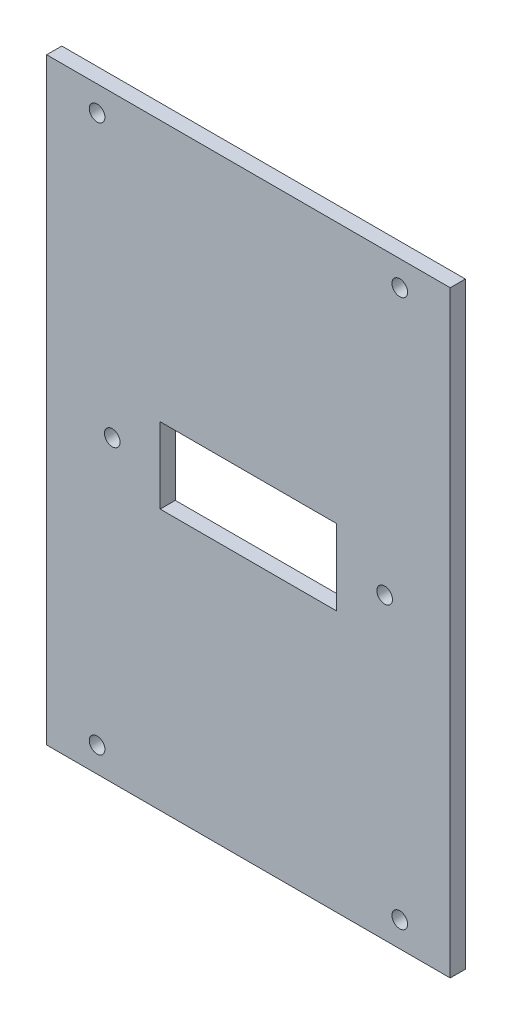
from build123d import *

# Parameters (mm, degrees)
SKETCH_1_W          = 80
SKETCH_1_H          = 118.5
SKETCH_1_W_2        = 35
SKETCH_1_H_2        = 15
EXTRUDE_1_DEPTH     = 3
CUT_EXTRUDE_2_REACH = 145.008
SKETCH_3_R          = 1.55
CUT_EXTRUDE_3_REACH = 145.008
SKETCH_4_R          = 1.55


with BuildPart() as part:
    # 草图1 → 凸台-拉伸1 (new body)
    with BuildSketch(Plane.XY):
        with Locations((40, 59.25)):
            Rectangle(SKETCH_1_W, SKETCH_1_H)
        with Locations((40, 59.25)):
            Rectangle(SKETCH_1_W_2, SKETCH_1_H_2, mode=Mode.SUBTRACT)
    extrude(amount=EXTRUDE_1_DEPTH)

    # 草图3 → 切除-拉伸2 (cut, up to next)
    with BuildSketch(Plane.XY.offset(3), mode=Mode.PRIVATE) as cut_extrude_2_sk1:
        with Locations((10, 113.5)):
            Circle(SKETCH_3_R)
    cut_extrude_2_tool1 = extrude(cut_extrude_2_sk1.sketch, amount=-CUT_EXTRUDE_2_REACH, mode=Mode.PRIVATE) & part.part
    # 草图3 → 切除-拉伸2 (cut, up to next)
    with BuildSketch(Plane.XY.offset(3), mode=Mode.PRIVATE) as cut_extrude_2_sk2:
        with Locations((70, 113.5)):
            Circle(SKETCH_3_R)
    cut_extrude_2_tool2 = extrude(cut_extrude_2_sk2.sketch, amount=-CUT_EXTRUDE_2_REACH, mode=Mode.PRIVATE) & part.part
    # 草图3 → 切除-拉伸2 (cut, up to next)
    with BuildSketch(Plane.XY.offset(3), mode=Mode.PRIVATE) as cut_extrude_2_sk3:
        with Locations((70, 5)):
            Circle(SKETCH_3_R)
    cut_extrude_2_tool3 = extrude(cut_extrude_2_sk3.sketch, amount=-CUT_EXTRUDE_2_REACH, mode=Mode.PRIVATE) & part.part
    # 草图3 → 切除-拉伸2 (cut, up to next)
    with BuildSketch(Plane.XY.offset(3), mode=Mode.PRIVATE) as cut_extrude_2_sk4:
        with Locations((10, 5)):
            Circle(SKETCH_3_R)
    cut_extrude_2_tool4 = extrude(cut_extrude_2_sk4.sketch, amount=-CUT_EXTRUDE_2_REACH, mode=Mode.PRIVATE) & part.part
    add(cut_extrude_2_tool1.solids().sort_by_distance((10, 113.5, 3))[0], mode=Mode.SUBTRACT)
    add(cut_extrude_2_tool2.solids().sort_by_distance((70, 113.5, 3))[0], mode=Mode.SUBTRACT)
    add(cut_extrude_2_tool3.solids().sort_by_distance((70, 5, 3))[0], mode=Mode.SUBTRACT)
    add(cut_extrude_2_tool4.solids().sort_by_distance((10, 5, 3))[0], mode=Mode.SUBTRACT)

    # 草图4 → 切除-拉伸3 (cut, up to next)
    with BuildSketch(Plane(origin=(0, 0, 0), x_dir=(-1, 0, 0), z_dir=(0, 0, -1)), mode=Mode.PRIVATE) as cut_extrude_3_sk1:
        with Locations((-67, 59.25)):
            Circle(SKETCH_4_R)
    cut_extrude_3_tool1 = extrude(cut_extrude_3_sk1.sketch, amount=-CUT_EXTRUDE_3_REACH, mode=Mode.PRIVATE) & part.part
    # 草图4 → 切除-拉伸3 (cut, up to next)
    with BuildSketch(Plane(origin=(0, 0, 0), x_dir=(-1, 0, 0), z_dir=(0, 0, -1)), mode=Mode.PRIVATE) as cut_extrude_3_sk2:
        with Locations((-13, 59.25)):
            Circle(SKETCH_4_R)
    cut_extrude_3_tool2 = extrude(cut_extrude_3_sk2.sketch, amount=-CUT_EXTRUDE_3_REACH, mode=Mode.PRIVATE) & part.part
    add(cut_extrude_3_tool1.solids().sort_by_distance((67, 59.25, 0))[0], mode=Mode.SUBTRACT)
    add(cut_extrude_3_tool2.solids().sort_by_distance((13, 59.25, 0))[0], mode=Mode.SUBTRACT)


solid = part.part
